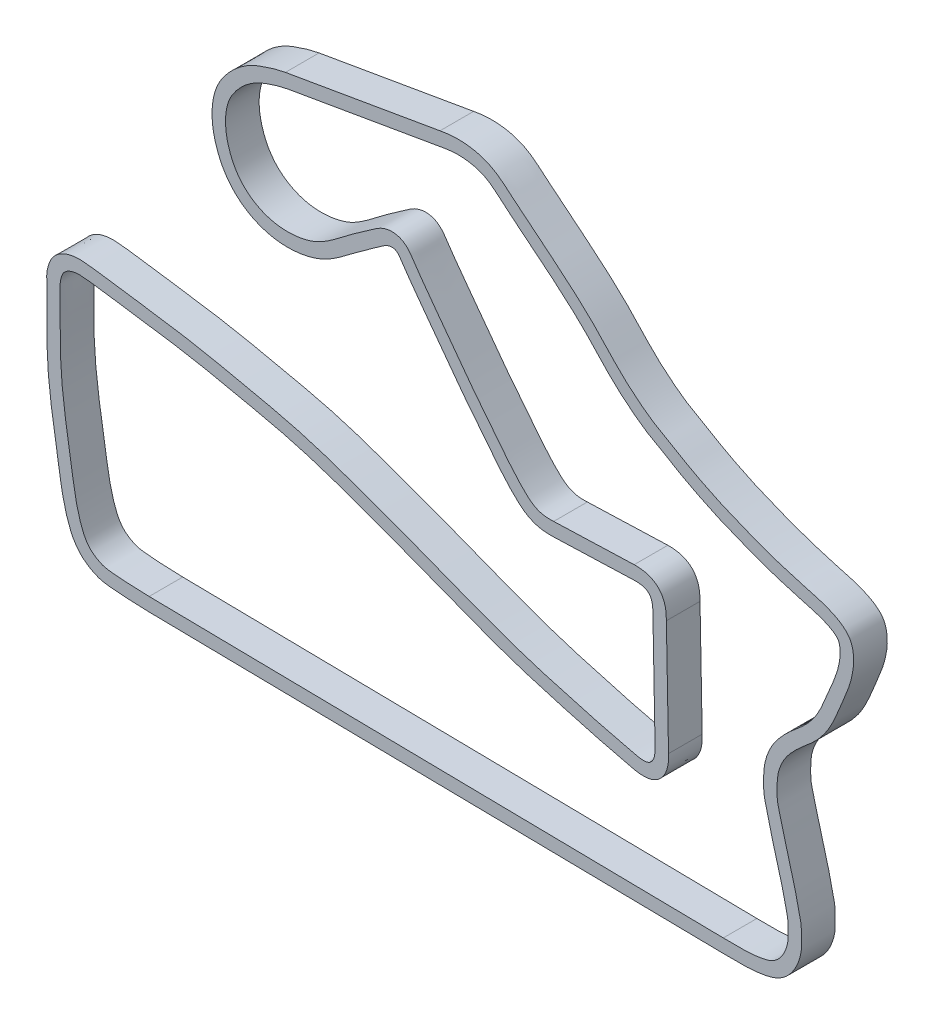
from build123d import *

# Parameters (mm, degrees)
BOSS_EXTRUDE1_DEPTH = 25.4


with BuildPart() as part:
    # Sketch1 → Boss-Extrude1 (new body)
    with BuildSketch(Plane.XY):
        with BuildLine():
            Line((510.948052258, 0), (77.568867003, 6.513353528))
            add(Edge.make_bspline(
                [(77.568867003, 6.513353528), (69.030728587, 6.641675137), (55.964005037, 7.369579283), (40.619041764, 8.962681121), (32.520389831, 13.062197763), (22.340509454, 20.632128838), (13.37293322, 40.995751909), (9.64727267, 68.132555503), (4.518112533, 98.566856348), (0.888212171, 127.345546067), (0.243313676, 155.813105447), (0.796433318, 176.596094605), (0.231593183, 189.683032719), (1.817976997, 195.772330326), (3.969365909, 201.111279782), (8.445075768, 206.051727156), (15.426999324, 209.808150677), (25.187426391, 211.339964649), (48.241253614, 208.234524629), (77.101494294, 204.087879138), (114.230932258, 198.475524376), (150.520531401, 190.553781654), (190.249150629, 182.194634337), (246.070987082, 163.295131018), (294.761597926, 144.48794029), (340.355184506, 126.646570623), (368.949494388, 116.994564879), (398.232954792, 108.82512586), (423.483106585, 101.891766343), (439.265784543, 98.319066993), (447.287916927, 96.186627876), (451.586233083, 95.942868872), (456.007298367, 96.71723885), (459.710546879, 101.967401294), (459.673627387, 107.096180764), (459.622470964, 109.787147582)],
                knots=[0, 0, 0, 0, 0.037553743, 0.051675274, 0.06341315, 0.074522355, 0.103523939, 0.15100199, 0.188457487, 0.230816561, 0.270760544, 0.305807001, 0.316980103, 0.3244308, 0.331625629, 0.340566304, 0.351322267, 0.363770868, 0.380669469, 0.446973148, 0.484528158, 0.535660665, 0.600414836, 0.652006859, 0.778824976, 0.816085081, 0.854228161, 0.903418232, 0.941675071, 0.962299193, 0.97037132, 0.975801833, 0.980081757, 0.988237124, 1, 1, 1, 1], degree=3))
            Line((459.622470964, 109.787147582), (457.987392708, 195.796705296))
            add(Edge.make_bspline(
                [(457.987392708, 195.796705296), (457.967490098, 196.843636645), (457.891662231, 198.896187568), (457.622623229, 201.827375913), (456.841412297, 204.671863441), (455.213625657, 207.490902585), (452.287680225, 209.324394914), (448.50392316, 210.233281687), (445.799968277, 210.415413959), (444.208360226, 210.360282958)],
                knots=[0, 0, 0, 0, 0.133759242, 0.259768248, 0.37304448, 0.506547964, 0.662787354, 0.794589909, 1, 1, 1, 1], degree=3))
            Line((444.208360226, 210.360282958), (383.443399876, 208.255472584))
            add(Edge.make_bspline(
                [(383.443399876, 208.255472584), (380.654226775, 208.15885966), (375.280764537, 208.163684824), (368.045334419, 209.957056426), (362.170112945, 212.983787892), (357.684334704, 216.390098997), (348.113215785, 225.347373543), (338.01326167, 237.992346732), (324.805335562, 254.602800783), (312.246963495, 270.660217661), (298.545736406, 289.442546536), (284.590190359, 308.224393568), (274.527618279, 321.963789608), (268.593941791, 330.548653617), (266.155483312, 334.362737176), (263.593299438, 336.497895803), (260.420108869, 336.858659488), (256.39910491, 335.719713316), (250.553914429, 331.361866757), (242.307412942, 325.802938943), (227.864562545, 315.24259751), (213.952537761, 303.809529439), (192.000062158, 296.908188226), (171.08149331, 296.360499132), (150.238977452, 305.175550348), (135.871318743, 318.917286155), (126.943320823, 337.291444998), (124.032158765, 357.594312144), (127.954304381, 376.191172031), (138.033269758, 390.521313405), (151.276548221, 401.562382496), (166.686521311, 407.312033441), (176.222002931, 409.941038251), (180.596038986, 410.696409758)],
                knots=[0, 0, 0, 0, 0.018810889, 0.03554016, 0.049383709, 0.062730234, 0.073095707, 0.13702697, 0.170537904, 0.215175917, 0.273365218, 0.326069889, 0.371729283, 0.387280673, 0.395894573, 0.40198787, 0.408845865, 0.416254491, 0.429510372, 0.457056778, 0.483027139, 0.549403055, 0.57496845, 0.635951455, 0.684859285, 0.72240142, 0.766603351, 0.819026654, 0.85694758, 0.890594014, 0.93445833, 0.969956567, 1, 1, 1, 1], degree=3))
            Line((180.596038986, 410.696409758), (297.281003035, 430.847248938))
            add(Edge.make_bspline(
                [(297.281003035, 430.847248938), (300.034357121, 431.322737754), (306.603516737, 432.346299455), (316.916246984, 432.245606968), (328.463277027, 430.166073006), (340.273379495, 424.935961335), (354.848764078, 411.909311159), (375.404197197, 395.575288586), (397.73116387, 377.218326557), (418.162331408, 357.954190535), (432.029256665, 341.846826249), (447.325447689, 328.821935975), (459.184433634, 319.831044682), (471.65903681, 313.514496614), (480.194498146, 308.296774442), (487.526117908, 303.872620687), (495.840819778, 299.725991428), (506.762410547, 294.195534394), (531.087772775, 283.934775855), (559.595055945, 273.36219233), (587.832661316, 266.798602429), (600.799391745, 260.166074984), (607.055472768, 253.834751887), (609.561604572, 245.877036708), (609.673062989, 236.021877094), (606.677781579, 222.094884874), (600.265705095, 207.771615283), (594.883618797, 194.295463346), (588.639541784, 182.635257129), (579.781471959, 171.977727336), (569.572098995, 164.231918965), (562.566691985, 157.06555921), (558.130924613, 151.848679425), (554.851305595, 145.800111699), (551.915420971, 137.970335053), (551.56761943, 129.123301291), (551.742066227, 119.157654193), (554.175446648, 111.369336951), (556.801225502, 100.231330927), (560.757801353, 85.134073054), (565.586299765, 68.767121719), (568.235700017, 55.948491994), (570.157436182, 47.920362657), (570.043428432, 40.359634956), (570.468170493, 32.054965541), (568.446302353, 23.756378752), (565.074127328, 16.39731597), (559.983589885, 9.554118765), (552.489040221, 3.880670293), (543.093075462, 1.411022084), (529.190090122, -0.441241168), (518.595728753, -0.114938655), (510.948052258, 0)],
                knots=[0, 0, 0, 0, 0.0122747, 0.029125367, 0.04500914, 0.063545861, 0.084923288, 0.130314231, 0.179055588, 0.211691381, 0.25352597, 0.27204927, 0.299843856, 0.318569353, 0.333311676, 0.343765783, 0.356145831, 0.374083225, 0.397503071, 0.472003458, 0.507370569, 0.524214459, 0.535352764, 0.545335874, 0.559970477, 0.578222887, 0.607407655, 0.628665351, 0.641923049, 0.66534492, 0.68877601, 0.697981987, 0.709327812, 0.718686907, 0.728065134, 0.745775031, 0.757063316, 0.771668458, 0.781283631, 0.807363115, 0.840162181, 0.856109978, 0.864893489, 0.876245051, 0.889154013, 0.901241586, 0.913299075, 0.924502134, 0.938411877, 0.953595749, 0.966528787, 1, 1, 1, 1], degree=3))
        make_face()
        with BuildLine():
            Line((511.100731948, 10.158852736), (77.721546692, 16.672206264))
            add(Edge.make_bspline(
                [(77.721546692, 16.672206264), (76.854307357, 16.6852402), (75.134834285, 16.719142414), (71.577511195, 16.820453248), (67.02028735, 17.00711712), (61.424767866, 17.322765139), (56.714608015, 17.657046489), (52.973208835, 17.965660085), (49.195058587, 18.296469362), (46.040934772, 18.670662955), (43.886539293, 19.177996413), (42.825672581, 19.513331676), (41.700937374, 19.935444197), (40.222742415, 20.613398748), (38.336235947, 21.668920083), (36.425517324, 22.897534417), (34.222287054, 24.547876578), (32.158940501, 26.571178729), (29.869408294, 29.859916244), (27.838163608, 33.92103261), (26.067920201, 38.602552826), (24.528019496, 43.621909596), (23.238671201, 48.699389414), (21.767976549, 55.642778041), (20.576918334, 62.818549664), (19.449004883, 70.232083069), (18.2747088, 77.782212301), (16.762014363, 87.121286484), (14.427095194, 101.949510213), (12.466653162, 116.633722754), (11.249598057, 131.189042044), (10.755537565, 142.184884241), (10.614605859, 151.428321624), (10.631950583, 158.835260991), (10.691139619, 164.458885299), (10.751101451, 170.16269603), (10.766265329, 174.984158834), (10.734049814, 178.89049287), (10.691789429, 181.341529352), (10.638761674, 183.336152621), (10.586507921, 185.167155934), (10.571851398, 186.754715706), (10.628231793, 188.086039449), (10.706010053, 188.949256708), (10.819592369, 189.70503374), (11.057193843, 190.850767829), (11.430786591, 192.152683859), (11.89350946, 193.486439012), (12.217327816, 194.293026865), (12.535010142, 194.960210959), (12.807906564, 195.438734501), (13.131519265, 195.911397716), (13.664204385, 196.569455415), (14.498896289, 197.392146539), (16.10862651, 198.586936468), (18.064871543, 199.532440845), (20.306215073, 200.164056127), (22.169367553, 200.491148564), (24.160499277, 200.658750593), (26.968177315, 200.674052321), (30.146770491, 200.401049028), (33.670660212, 199.94274489), (37.439313138, 199.424735995), (42.109736919, 198.782772876), (47.722766101, 197.999789124), (55.194239967, 196.946881778), (64.526056964, 195.611284526), (75.713765849, 193.978315102), (86.919951693, 192.32230321), (98.045824172, 190.622922835), (109.038064034, 188.781951359), (123.619432933, 185.998502847), (138.32504441, 182.831974221), (153.162109577, 179.654093064), (167.844709877, 176.462184906), (182.308602536, 173.043524779), (196.429061252, 169.044944616), (210.553137014, 164.600278667), (228.260180812, 158.448731238), (249.49642194, 150.756821579), (270.65082829, 142.819871415), (288.25381193, 136.058096564), (302.337153059, 130.592302021), (312.888319665, 126.476526158), (323.501847953, 122.337449269), (334.241974273, 118.260159487), (345.124554066, 114.3558015), (356.063296483, 110.673726959), (367.080837456, 107.202714761), (378.101397691, 103.944700738), (389.112216464, 100.828394635), (398.24018348, 98.301325965), (405.570369769, 96.28287326), (411.098429149, 94.784509377), (416.657004742, 93.314842155), (422.243435512, 91.886767137), (426.942934463, 90.744516645), (430.640129579, 89.869150418), (433.386156238, 89.218636078), (436.096751739, 88.568067274), (438.346441651, 88.014201188), (440.093752898, 87.570171681), (441.540399735, 87.199461702), (443.146575375, 86.813302223), (444.912400949, 86.444128292), (446.854190274, 86.131105948), (448.945141695, 85.922452539), (451.199257922, 85.871300956), (453.118373343, 85.980030265), (454.962608127, 86.241232491), (456.506595178, 86.582946232), (458.194217373, 87.122278622), (460.044702167, 87.974745735), (461.679340718, 89.009202031), (463.575878254, 90.539045805), (465.442059483, 92.622161022), (467.05635518, 95.180481834), (468.21221738, 97.746280893), (468.988378565, 100.261759723), (469.45288745, 102.616476399), (469.697603332, 104.78675152), (469.795337929, 106.755205498), (469.80509822, 108.211561381), (469.793648993, 109.270286537), (469.785231208, 109.738515468), (469.780635568, 109.980258609)],
                knots=[0, 0, 0, 0, 0.00390625, 0.0078125, 0.015625, 0.0234375, 0.03125, 0.03515625, 0.0390625, 0.046875, 0.05078125, 0.052734375, 0.0546875, 0.05859375, 0.0625, 0.06640625, 0.0703125, 0.078125, 0.0859375, 0.09375, 0.1015625, 0.109375, 0.1171875, 0.125, 0.140625, 0.1484375, 0.15625, 0.171875, 0.1875, 0.21875, 0.234375, 0.25, 0.265625, 0.2734375, 0.28125, 0.2890625, 0.296875, 0.30078125, 0.3046875, 0.306640625, 0.30859375, 0.3125, 0.314453125, 0.31640625, 0.318359375, 0.3203125, 0.32421875, 0.326171875, 0.328125, 0.330078125, 0.33203125, 0.333984375, 0.3359375, 0.33984375, 0.34375, 0.3515625, 0.35546875, 0.359375, 0.36328125, 0.3671875, 0.375, 0.37890625, 0.3828125, 0.390625, 0.3984375, 0.40625, 0.421875, 0.4375, 0.453125, 0.46875, 0.484375, 0.5, 0.53125, 0.546875, 0.5625, 0.59375, 0.609375, 0.625, 0.65625, 0.6875, 0.71875, 0.75, 0.765625, 0.78125, 0.796875, 0.8125, 0.828125, 0.84375, 0.859375, 0.875, 0.890625, 0.90625, 0.9140625, 0.921875, 0.9296875, 0.9375, 0.9453125, 0.94921875, 0.953125, 0.95703125, 0.9609375, 0.962890625, 0.96484375, 0.966796875, 0.96875, 0.970703125, 0.97265625, 0.974609375, 0.9765625, 0.977539062, 0.978515625, 0.979492188, 0.98046875, 0.981445312, 0.982421875, 0.984375, 0.986328125, 0.98828125, 0.990234375, 0.9921875, 0.994140625, 0.99609375, 0.998046875, 0.999023438, 1, 1, 1, 1], degree=3))
            Line((469.780635568, 109.980258609), (468.145557312, 195.989816323))
            add(Edge.make_bspline(
                [(468.145557312, 195.989816323), (468.124122069, 197.117368325), (468.06542661, 198.740866165), (467.890992132, 201.170984948), (467.618274245, 203.367219792), (467.089146433, 205.819376973), (466.233957067, 208.37568253), (465.148686975, 210.612340259), (463.95034249, 212.444937292), (462.852733409, 213.82188908), (461.561171141, 215.124859488), (459.801342647, 216.56825724), (457.537187519, 217.958107835), (454.797067604, 219.102124656), (452.274934087, 219.782452678), (450.156286595, 220.16375234), (447.367542355, 220.502642426), (445.258396455, 220.562748001), (443.856643452, 220.514193304)],
                knots=[0, 0, 0, 0, 0.125, 0.1875, 0.25, 0.3125, 0.375, 0.4375, 0.46875, 0.5, 0.53125, 0.5625, 0.625, 0.6875, 0.75, 0.8125, 0.875, 1, 1, 1, 1], degree=3))
            Line((443.856643452, 220.514193304), (383.091683102, 218.40938293))
            add(Edge.make_bspline(
                [(383.091683102, 218.40938293), (382.574522877, 218.391469247), (381.523052477, 218.363072206), (379.554029732, 218.355255199), (377.269796581, 218.4549485), (374.898854096, 218.786003443), (372.583309169, 219.373376034), (370.451510334, 220.187074624), (367.595259043, 221.667478159), (364.804103158, 223.705366989), (361.90351754, 226.346950921), (358.835695349, 229.369518426), (355.146221877, 233.315467609), (350.79401961, 238.376675497), (346.490604773, 243.661996754), (342.1366834, 249.13551531), (336.331587254, 256.432745782), (329.122649453, 265.551296107), (320.681667103, 276.488248523), (313.801828444, 285.780396849), (308.277561805, 293.299859914), (304.106364536, 298.964400442), (299.9335012, 304.605417511), (295.767355701, 310.234095734), (292.304811334, 314.921161156), (289.550823757, 318.664038355), (287.498491465, 321.467317542), (285.461716509, 324.269140033), (283.442861443, 327.071901307), (281.44701921, 329.875081063), (279.798036914, 332.220637288), (278.516739863, 334.071417368), (277.734436042, 335.21923695), (277.119750868, 336.134985919), (276.667611338, 336.815334288), (276.212427237, 337.511686847), (275.422238288, 338.701858338), (274.350129793, 340.192218007), (272.865869864, 341.850031613), (271.458477821, 343.169205213), (269.948434053, 344.283563365), (268.501994097, 345.111712188), (266.851171517, 345.872881006), (264.826168128, 346.486498055), (262.55618029, 346.820297463), (260.455944363, 346.860091136), (257.848357076, 346.619812514), (254.92784901, 345.884036151), (251.995853187, 344.619539804), (249.620184195, 343.237162896), (248.039966382, 342.153881588), (246.963560911, 341.381120877), (246.032165755, 340.70549416), (244.908733503, 339.90303175), (243.517247494, 338.922916866), (242.112843808, 337.944188562), (240.214034878, 336.628604664), (237.800735904, 334.961244759), (234.844281188, 332.884995418), (231.918164297, 330.778403098), (229.013580085, 328.641944108), (225.146896139, 325.734911417), (220.483982406, 322.135944568), (215.104913339, 318.145344166), (209.852772613, 314.673148988), (205.549219259, 312.35568276), (202.095363002, 310.895919131), (198.451238049, 309.618429375), (193.611121201, 308.376534086), (185.660803396, 307.178229299), (177.682274756, 307.258463355), (170.057367808, 308.685638271), (162.664011228, 311.042135306), (154.183711812, 315.623635395), (147.253624425, 322.207491428), (142.952791463, 328.389529512), (139.351427709, 335.28811552), (136.191698289, 344.955570361), (135.137381023, 354.761540895), (135.688191849, 362.528690145), (136.634300749, 367.112118458), (137.762465762, 370.517983852), (139.118628444, 373.684011839), (141.413923674, 377.574413542), (145.081373142, 382.176940761), (149.307128668, 386.440438922), (153.098849128, 389.474975537), (156.287929534, 391.574684095), (159.536877654, 393.420262894), (163.13951058, 395.039037028), (167.051839631, 396.49764355), (170.137242591, 397.533656593), (173.303217825, 398.520400827), (176.379844216, 399.388991275), (179.411559378, 400.129807044), (181.341803291, 400.514809479), (182.325021416, 400.684605737)],
                knots=[0, 0, 0, 0, 0.00390625, 0.0078125, 0.015625, 0.0234375, 0.03125, 0.0390625, 0.046875, 0.0625, 0.0703125, 0.078125, 0.09375, 0.109375, 0.125, 0.140625, 0.15625, 0.1875, 0.21875, 0.25, 0.265625, 0.28125, 0.296875, 0.3125, 0.328125, 0.3359375, 0.34375, 0.3515625, 0.359375, 0.3671875, 0.375, 0.37890625, 0.3828125, 0.384765625, 0.38671875, 0.388671875, 0.390625, 0.39453125, 0.396484375, 0.3984375, 0.400390625, 0.401367188, 0.40234375, 0.404296875, 0.40625, 0.408203125, 0.41015625, 0.4140625, 0.41796875, 0.421875, 0.42578125, 0.427734375, 0.4296875, 0.43359375, 0.4375, 0.44140625, 0.4453125, 0.453125, 0.4609375, 0.46875, 0.4765625, 0.484375, 0.5, 0.515625, 0.53125, 0.546875, 0.5546875, 0.5625, 0.578125, 0.59375, 0.625, 0.640625, 0.65625, 0.6875, 0.71875, 0.734375, 0.75, 0.78125, 0.8125, 0.828125, 0.84375, 0.8515625, 0.859375, 0.875, 0.890625, 0.90625, 0.921875, 0.9296875, 0.9375, 0.953125, 0.9609375, 0.96875, 0.9765625, 0.984375, 0.9921875, 1, 1, 1, 1], degree=3))
            Line((182.325021416, 400.684605737), (299.009985466, 420.835444917))
            add(Edge.make_bspline(
                [(299.009985466, 420.835444917), (299.833914464, 420.977732837), (301.507931653, 421.257551248), (304.67000762, 421.717376707), (308.347005696, 422.061225835), (312.836386371, 422.079928411), (317.372456666, 421.726470242), (321.745083471, 421.013769064), (325.866931184, 419.91666312), (329.822613989, 418.381091058), (332.889783043, 416.767836661), (335.178948689, 415.281932078), (337.552094601, 413.557760774), (340.020963625, 411.5299101), (342.633143123, 409.2782727), (345.392566381, 406.891067823), (348.876885146, 403.942414735), (353.056825829, 400.476588907), (358.634226721, 395.923717132), (365.584668606, 390.333727962), (373.829789878, 383.673687814), (381.967140273, 376.963053062), (389.942271572, 370.163898403), (397.705384452, 363.22866985), (405.208566838, 356.115415316), (412.296892319, 348.793857308), (419.529314587, 340.906249188), (425.959886494, 334.211432838), (431.565864401, 328.975404803), (435.839791787, 325.273334846), (440.118281686, 321.751198467), (444.52198554, 318.270263856), (449.142997379, 314.859287761), (453.177374582, 312.146075856), (456.572446132, 310.069458197), (459.932041167, 308.146630788), (463.151509341, 306.413716066), (466.190256812, 304.761250964), (469.061200129, 303.147134274), (472.73190196, 300.960089703), (476.514441207, 298.646473312), (479.716343252, 296.734808805), (482.249577477, 295.284317196), (484.823098552, 293.903082763), (488.156386197, 292.195214158), (492.098344946, 290.22638521), (496.944007355, 287.793898596), (501.971799958, 285.372388101), (507.057809255, 283.085314849), (512.116093175, 280.92535211), (517.133828696, 278.856544594), (527.175341521, 274.796124816), (539.066218882, 270.272317364), (552.926777113, 265.610184938), (561.712040515, 262.944339818), (568.833608123, 261.000951064), (575.67720449, 259.192003005), (583.647774183, 256.88664712), (590.810632183, 253.950736841), (594.583475122, 251.553272299), (596.37184967, 250.063990187), (597.184536313, 249.211372387), (597.653182628, 248.60616333), (597.907334768, 248.218002663), (598.115070847, 247.833630098), (598.420275004, 247.144914027), (598.778990334, 246.033267025), (599.234402503, 243.758526071), (599.439115059, 240.65003742), (599.141734006, 236.416777332), (598.390781126, 232.069347332), (597.23478734, 227.650632899), (595.722428586, 223.164273272), (593.912048509, 218.535907091), (592.230791245, 214.543661138), (590.833218846, 211.254311076), (589.41810215, 207.880228236), (587.738344841, 203.807135698), (585.73349406, 199.170532406), (583.643656205, 194.825827042), (581.399372701, 190.813237616), (578.908989189, 187.123893028), (576.061039526, 183.577606591), (573.453614577, 180.81192371), (571.234043314, 178.716582602), (568.809341258, 176.5638059), (565.477528266, 173.759842893), (561.859676126, 170.641461897), (558.922362648, 167.846877916), (556.832068752, 165.714725276), (554.844039459, 163.574453001), (552.810636662, 161.248362021), (550.785947828, 158.689632829), (548.824286399, 155.814971037), (547.137369752, 152.870319991), (545.693640536, 149.924715822), (544.408283462, 146.868539424), (543.28562956, 143.569772403), (542.43491671, 140.045404954), (541.922530368, 136.681099326), (541.637424901, 133.445365975), (541.5337985, 130.882982133), (541.498252599, 128.90659277), (541.484590055, 127.01330614), (541.495636001, 124.541347918), (541.619416352, 121.855258177), (541.836357527, 119.603961988), (542.160764811, 117.254596597), (542.715191463, 114.530828259), (543.469133533, 111.585214483), (544.213171547, 108.92241358), (544.839840778, 106.587125836), (545.448857773, 104.113510855), (546.072802082, 101.514623967), (546.725030541, 98.858641273), (547.60764766, 95.345173056), (548.744976575, 90.957906437), (550.155149407, 85.714091737), (551.610180928, 80.491729295), (553.055538445, 75.366293612), (554.448084734, 70.315184702), (555.752916442, 65.321626508), (556.715630891, 61.238213891), (557.465726265, 57.83305668), (558.035442201, 55.22232747), (558.527983912, 52.994677689), (558.940907037, 51.193426651), (559.307405705, 49.579853776), (559.588606462, 48.169412365), (559.747438071, 47.053909524), (559.860710467, 45.867500233), (559.93626614, 44.080627276), (559.950457888, 41.964424396), (559.977648018, 40.023652743), (560.020671569, 38.19036623), (560.06444192, 36.122379556), (560.028533479, 33.978555721), (559.877720015, 32.263363292), (559.556681031, 30.451255995), (559.071116771, 28.570061472), (558.423687094, 26.621848854), (557.413440952, 24.115132107), (555.876650949, 21.180445762), (554.025667706, 18.623848171), (552.400391104, 16.885546992), (551.083852086, 15.708314545), (549.698043947, 14.68530762), (548.285801448, 13.842485559), (546.832628562, 13.169247941), (544.519225758, 12.341658702), (541.724580825, 11.672768174), (538.62885248, 11.119816062), (535.539214567, 10.671622616), (531.603846401, 10.284519373), (526.726543508, 10.057059087), (521.683436697, 10.005037896), (517.34637685, 10.05493869), (513.806052671, 10.114878686), (511.999489446, 10.145345107), (511.100731948, 10.158852736)],
                knots=[0, 0, 0, 0, 0.00390625, 0.0078125, 0.015625, 0.0234375, 0.03125, 0.0390625, 0.046875, 0.0546875, 0.0625, 0.06640625, 0.0703125, 0.078125, 0.08203125, 0.0859375, 0.09375, 0.1015625, 0.109375, 0.125, 0.140625, 0.15625, 0.171875, 0.1875, 0.203125, 0.21875, 0.234375, 0.25, 0.2578125, 0.265625, 0.2734375, 0.28125, 0.2890625, 0.296875, 0.30078125, 0.3046875, 0.3125, 0.31640625, 0.3203125, 0.328125, 0.3359375, 0.33984375, 0.34375, 0.34765625, 0.3515625, 0.359375, 0.3671875, 0.375, 0.3828125, 0.390625, 0.3984375, 0.40625, 0.4375, 0.453125, 0.46875, 0.4765625, 0.484375, 0.5, 0.515625, 0.5234375, 0.52734375, 0.53125, 0.533203125, 0.53515625, 0.537109375, 0.5390625, 0.54296875, 0.546875, 0.5546875, 0.5625, 0.5703125, 0.578125, 0.5859375, 0.59375, 0.6015625, 0.60546875, 0.609375, 0.6171875, 0.625, 0.6328125, 0.640625, 0.6484375, 0.65625, 0.6640625, 0.66796875, 0.671875, 0.6796875, 0.6875, 0.69140625, 0.6953125, 0.69921875, 0.703125, 0.70703125, 0.7109375, 0.71484375, 0.71875, 0.72265625, 0.7265625, 0.73046875, 0.734375, 0.73828125, 0.7421875, 0.744140625, 0.74609375, 0.75, 0.75390625, 0.755859375, 0.7578125, 0.76171875, 0.765625, 0.76953125, 0.7734375, 0.77734375, 0.78125, 0.78515625, 0.7890625, 0.796875, 0.8046875, 0.8125, 0.8203125, 0.828125, 0.8359375, 0.84375, 0.84765625, 0.8515625, 0.85546875, 0.857421875, 0.859375, 0.86328125, 0.865234375, 0.8671875, 0.87109375, 0.875, 0.876953125, 0.87890625, 0.8828125, 0.88671875, 0.890625, 0.89453125, 0.8984375, 0.90234375, 0.90625, 0.9140625, 0.921875, 0.92578125, 0.9296875, 0.93359375, 0.9375, 0.94140625, 0.9453125, 0.953125, 0.95703125, 0.9609375, 0.96875, 0.9765625, 0.984375, 0.9921875, 0.99609375, 1, 1, 1, 1], degree=3))
        make_face(mode=Mode.SUBTRACT)
    extrude(amount=BOSS_EXTRUDE1_DEPTH)


solid = part.part
